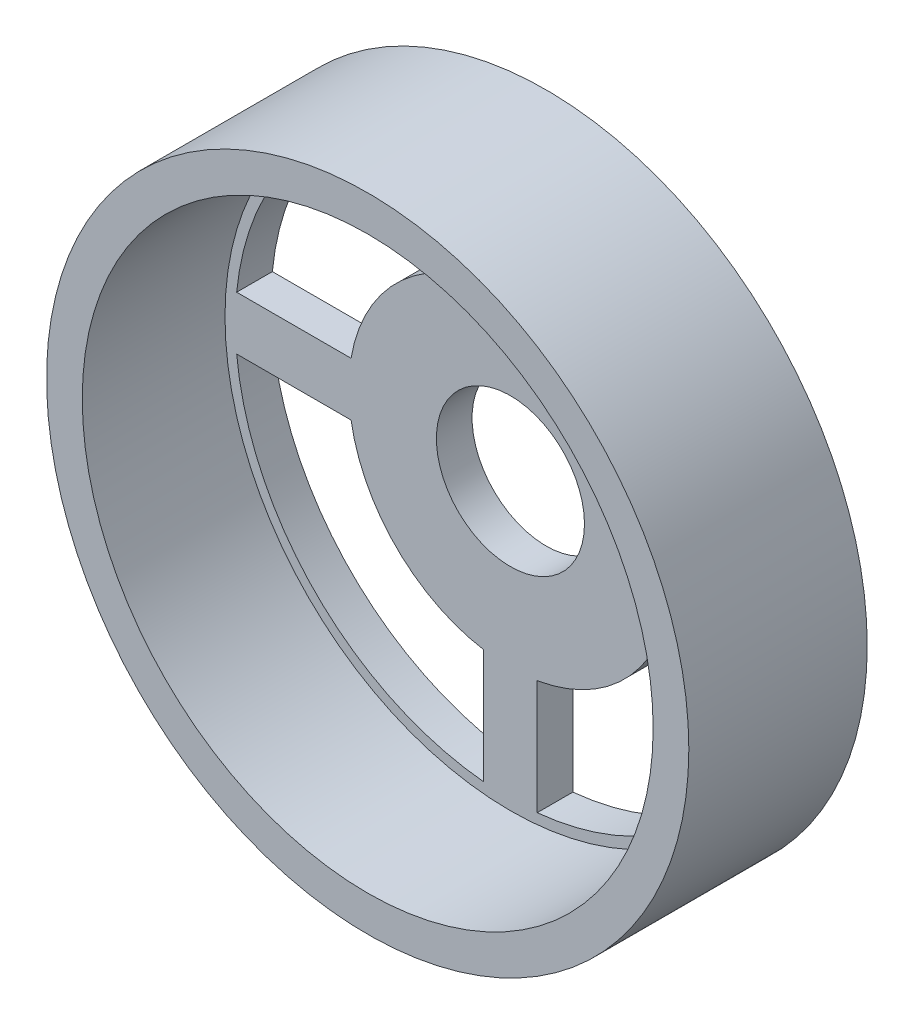
from build123d import *

# Parameters (mm, degrees)
ESBO_O1_R                = 16
ESBO_O1_R_2              = 4.15
RESSALTO_EXTRUS_O1_DEPTH = 2
ESBO_O2_R                = 18
ESBO_O2_R_2              = 16
RESSALTO_EXTRUS_O2_DEPTH = 10
CORTE_EXTRUS_O1_DEPTH    = 10


with BuildPart() as part:
    # Esboço1 → Ressalto-extrusão1 (new body)
    with BuildSketch(Plane.XY):
        Circle(ESBO_O1_R)
        Circle(ESBO_O1_R_2, mode=Mode.SUBTRACT)
    extrude(amount=RESSALTO_EXTRUS_O1_DEPTH)

    # Esboço2 → Ressalto-extrusão2 (add)
    with BuildSketch(Plane.XY):
        Circle(ESBO_O2_R)
        Circle(ESBO_O2_R_2, mode=Mode.SUBTRACT)
    extrude(amount=RESSALTO_EXTRUS_O2_DEPTH)

    # Esboço3 → Corte-extrusão1 (cut)
    with BuildSketch(Plane(origin=(0, 0, 0), x_dir=(-1, 0, 0), z_dir=(0, 0, -1))):
        with BuildLine():
            ThreePointArc((-1.5, -8.932222345), (-6.404474843, -6.404474843), (-8.932222345, -1.5))
            Line((-8.932222345, -1.5), (-15.344338178, -1.5))
            ThreePointArc((-15.344338178, -1.5), (-10.90180522, -10.90180522), (-1.5, -15.344338178))
            Line((-1.5, -15.344338178), (-1.5, -8.932222345))
        make_face()
        with BuildLine():
            ThreePointArc((8.932222345, -1.5), (6.404474843, -6.404474843), (1.5, -8.932222345))
            Line((1.5, -8.932222345), (1.5, -15.344338178))
            ThreePointArc((1.5, -15.344338178), (10.90180522, -10.90180522), (15.344338178, -1.5))
            Line((15.344338178, -1.5), (8.932222345, -1.5))
        make_face()
        with BuildLine():
            ThreePointArc((1.5, 8.932222345), (6.404474843, 6.404474843), (8.932222345, 1.5))
            Line((8.932222345, 1.5), (15.344338178, 1.5))
            ThreePointArc((15.344338178, 1.5), (10.90180522, 10.90180522), (1.5, 15.344338178))
            Line((1.5, 15.344338178), (1.5, 8.932222345))
        make_face()
        with BuildLine():
            ThreePointArc((-8.932222345, 1.5), (-6.404474843, 6.404474843), (-1.5, 8.932222345))
            Line((-1.5, 8.932222345), (-1.5, 15.344338178))
            ThreePointArc((-1.5, 15.344338178), (-10.90180522, 10.90180522), (-15.344338178, 1.5))
            Line((-15.344338178, 1.5), (-8.932222345, 1.5))
        make_face()
    extrude(amount=-CORTE_EXTRUS_O1_DEPTH, mode=Mode.SUBTRACT)


solid = part.part
